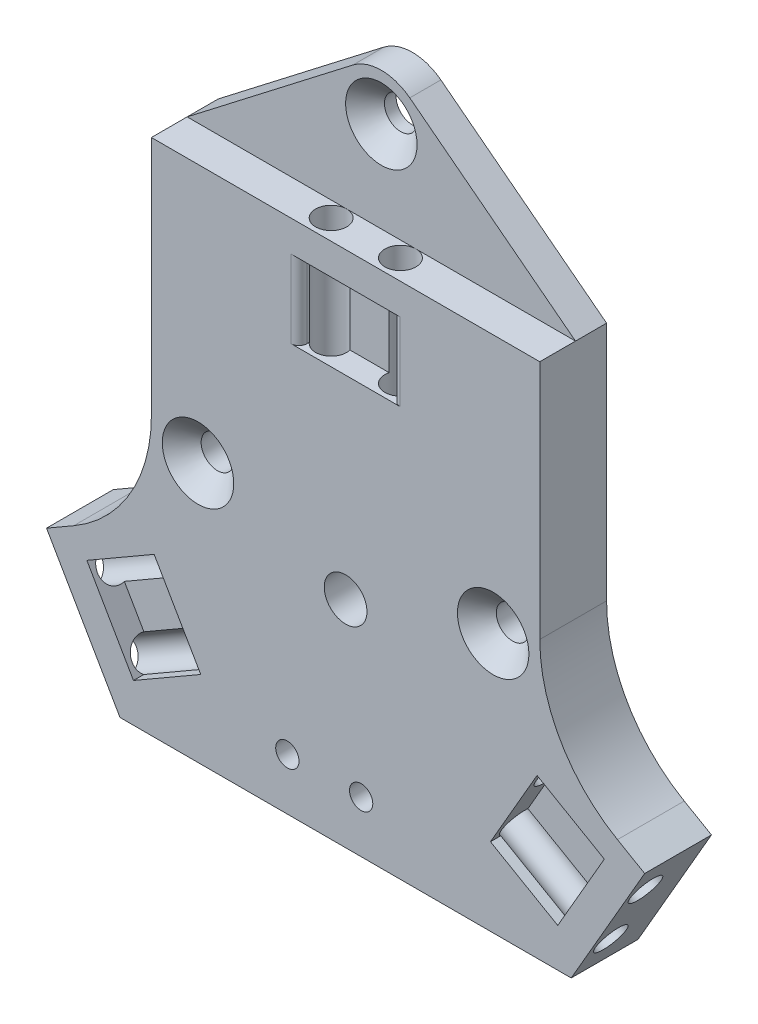
from build123d import *

# Parameters (mm, degrees)
BOSS_EXTRUDE1_DEPTH      = 2.6
BOSS_EXTRUDE1_DEPTH_BACK = 6
FILLET1_R                = 20
CUT_EXTRUDE1_DEPTH       = 5
SKETCH5_R                = 2
CUT_EXTRUDE2_DEPTH       = 20
FILLET3_R                = 1
CIRPATTERN1_COUNT        = 3
SKETCH6_R                = 2.75
CUT_EXTRUDE3_DEPTH       = 56.475677209
BOSS_EXTRUDE2_DEPTH      = 4
SKETCH8_R                = 2.1
CUT_EXTRUDE4_DEPTH       = 70.075616261
CHAMFER1_SIZE            = 2.5
SKETCH9_R                = 1.5
CUT_EXTRUDE5_DEPTH       = 70.075616261


with BuildPart() as part:
    # Sketch3 → Boss-Extrude1 (new, two sides: drawn at the far end of the back side and taken through both)
    with BuildSketch(Plane.XY.offset(-BOSS_EXTRUDE1_DEPTH_BACK)):
        Polygon((-25, 39), (25, 39), (25, -3.511595657), (38.504425224, -11.308379196), (33.774990748, -19.5), (29.045556271, -27.691620804), (-29.045556271, -27.691620804), (-33.774990748, -19.5), (-38.504425224, -11.308379196), (-25, -3.511595657), align=None)
    extrude(amount=BOSS_EXTRUDE1_DEPTH + BOSS_EXTRUDE1_DEPTH_BACK)

    # Fillet1
    fillet1_edges = [part.edges().sort_by_distance(p)[0] for p in [
        (-25, -3.511595657, -1.7),
        (25, -3.511595657, -1.7),
    ]]
    fillet(fillet1_edges, radius=FILLET1_R)

    # Sketch4 → Cut-Extrude1 (cut, symmetric)
    with BuildSketch(Plane(origin=(0, 30, 0), x_dir=(1, 0, 0), z_dir=(0, 1, 0))):
        Polygon((5.114783638, 0.485216362), (-5.114783638, 0.485216362), (-6, -0.4), (-6, -2.6), (6, -2.6), (6, -0.4), align=None)
    cut_extrude1 = extrude(amount=CUT_EXTRUDE1_DEPTH, both=True, mode=Mode.SUBTRACT)

    # Sketch5 → Cut-Extrude2 (cut)
    with BuildSketch(Plane(origin=(0, 39, 0), x_dir=(1, 0, 0), z_dir=(0, 1, 0))):
        with Locations((-4.458868953, 0)):
            Circle(SKETCH5_R)
        with Locations((4.458868953, 0)):
            Circle(SKETCH5_R)
    cut_extrude2 = extrude(amount=-CUT_EXTRUDE2_DEPTH, mode=Mode.SUBTRACT)

    # Fillet3
    fillet3_edges = [part.edges().sort_by_distance(p)[0] for p in [
        (-6, 30, 2.6),
        (6, 30, 2.6),
    ]]
    fillet(fillet3_edges, radius=FILLET3_R)

    # CirPattern1: Cut-Extrude1, Cut-Extrude2 ×3 about axis
    cirpattern1_axis = Axis((0, 0, -80.9), (0, 0, 1))
    add([cut_extrude1.rotate(cirpattern1_axis, i * 360 / CIRPATTERN1_COUNT) for i in range(1, CIRPATTERN1_COUNT)], mode=Mode.SUBTRACT)
    add([cut_extrude2.rotate(cirpattern1_axis, i * 360 / CIRPATTERN1_COUNT) for i in range(1, CIRPATTERN1_COUNT)], mode=Mode.SUBTRACT)

    # Sketch6 → Cut-Extrude3 (cut, through all)
    with BuildSketch(Plane.XY.offset(2.6)):
        Circle(SKETCH6_R)
    extrude(amount=-CUT_EXTRUDE3_DEPTH, mode=Mode.SUBTRACT)

    # Sketch7 → Boss-Extrude2 (add)
    with BuildSketch(Plane(origin=(0, 0, -6), x_dir=(-1, 0, 0), z_dir=(0, 0, -1))):
        with BuildLine():
            Line((-25, 39), (-3.663721376, 55.451541401))
            ThreePointArc((-3.663721376, 55.451541401), (0, 56.7), (3.663721376, 55.451541401))
            Line((3.663721376, 55.451541401), (25, 39))
            Line((25, 39), (-25, 39))
        make_face()
    extrude(amount=-BOSS_EXTRUDE2_DEPTH)

    # Sketch8 → Cut-Extrude4 (cut, through all)
    with BuildSketch(Plane.XY.offset(2.6)):
        with Locations((-19, 5.7)):
            Circle(SKETCH8_R)
        with Locations((19, 5.7)):
            Circle(SKETCH8_R)
        with Locations((0, 50.7)):
            Circle(SKETCH8_R)
    extrude(amount=-CUT_EXTRUDE4_DEPTH, mode=Mode.SUBTRACT)

    # Chamfer1
    chamfer1_edges = [part.edges().sort_by_distance(p)[0] for p in [
        (-21.1, 5.7, 2.6),
        (16.9, 5.7, 2.6),
        (-2.1, 50.7, -2),
    ]]
    chamfer(chamfer1_edges, length=CHAMFER1_SIZE)

    # Sketch9 → Cut-Extrude5 (cut, through all)
    with BuildSketch(Plane(origin=(0, 0, -6), x_dir=(-1, 0, 0), z_dir=(0, 0, -1))):
        with Locations((7.5, -21.041620804)):
            Circle(SKETCH9_R)
        with Locations((-2, -21.041620804)):
            Circle(SKETCH9_R)
    extrude(amount=-CUT_EXTRUDE5_DEPTH, mode=Mode.SUBTRACT)


solid = part.part
